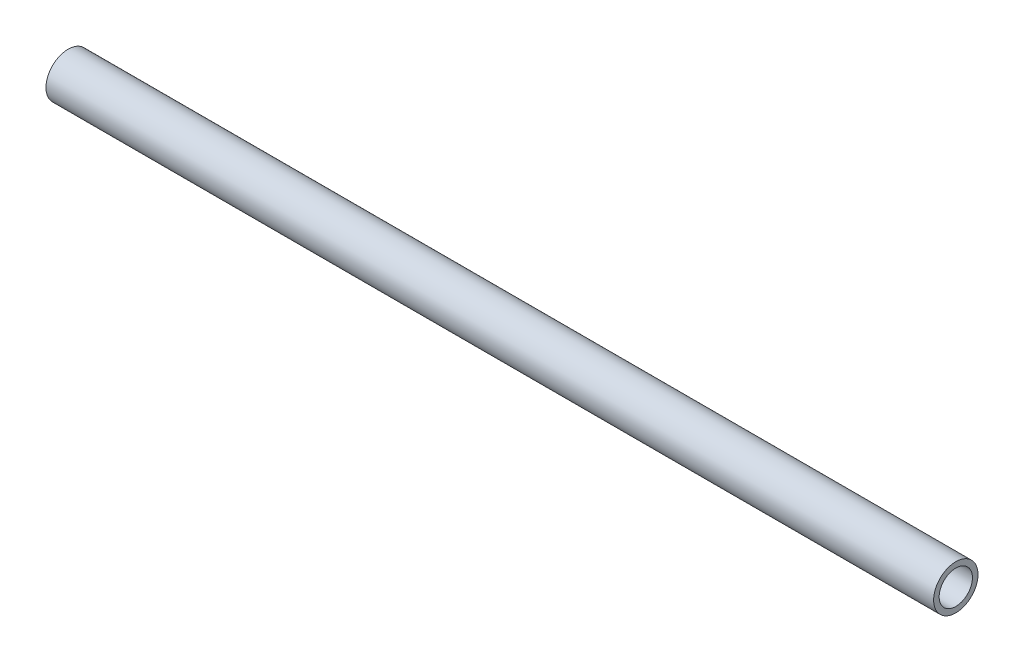
from build123d import *

# Parameters (mm, degrees)
SKETCH1_R          = 12.7
SKETCH1_R_2        = 9.525
EXTRUDE1_DEPTH     = 457.2
CUT_EXTRUDE1_START = -406.4
SKETCH3_R          = 12.7
CUT_EXTRUDE1_DEPTH = 406.4


with BuildPart() as part:
    # Sketch1 → Extrude1 (new, symmetric)
    with BuildSketch(Plane(origin=(0, 0, 0), x_dir=(0, 0, -1), z_dir=(1, 0, 0))):
        Circle(SKETCH1_R)
        Circle(SKETCH1_R_2, mode=Mode.SUBTRACT)
    extrude(amount=EXTRUDE1_DEPTH, both=True)

    # Sketch3 → Cut-Extrude1 (cut)
    with BuildSketch(Plane.ZY.offset(457.2).offset(CUT_EXTRUDE1_START)):
        with Locations(Location((0, 0, 0), (0, 0, 180))):
            Circle(SKETCH3_R)
    extrude(amount=CUT_EXTRUDE1_DEPTH, mode=Mode.SUBTRACT)


solid = part.part
